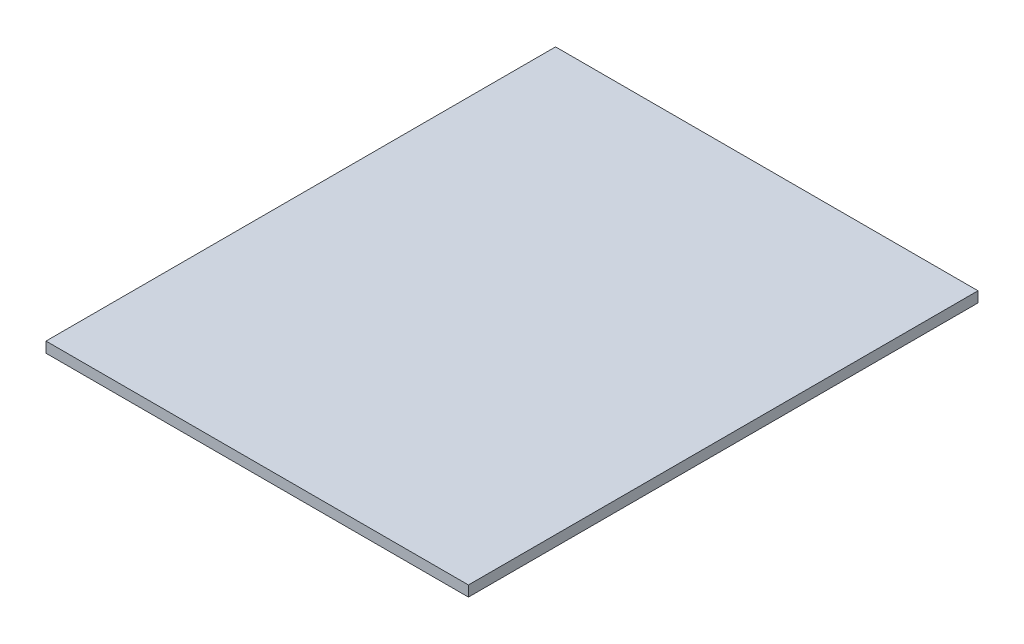
from build123d import *

# Parameters (mm, degrees)
SKETCH_1_W      = 800
SKETCH_1_H      = 965
EXTRUDE_1_DEPTH = 20


with BuildPart() as part:
    # 草图1 → 凸台-拉伸1 (new body)
    with BuildSketch(Plane(origin=(0, 0, 0), x_dir=(1, 0, 0), z_dir=(0, 1, 0))):
        with Locations((400, 482.5)):
            Rectangle(SKETCH_1_W, SKETCH_1_H)
    extrude(amount=EXTRUDE_1_DEPTH)


solid = part.part
